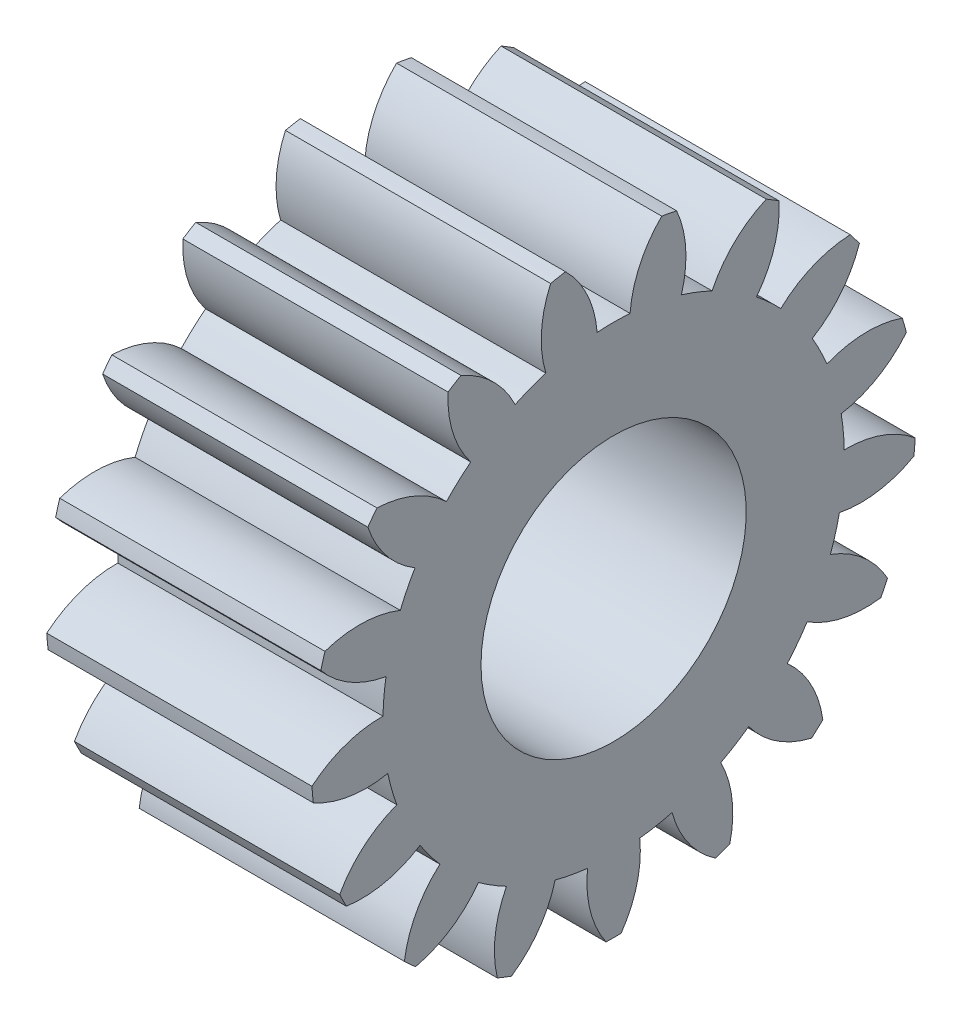
from build123d import *

# Parameters (mm, degrees)
BASPROSKE_W     = 5
BASPROSKE_H     = 5.7
TOOTHCUT_DEPTH  = 10.485778829
TEETHCUTS_COUNT = 17
TEETHCUTS_ANGLE = 338.823529412
BORSKE_R        = 2.5
BORE_DEPTH      = 50.0000508


with BuildPart() as part:
    # BasProSke → Base-Revolve (revolve)
    with BuildSketch(Plane(origin=(0, 0, 0), x_dir=(1, 0, 0), z_dir=(0, 1, 0)), mode=Mode.PRIVATE) as base_revolve_sk:
        with Locations((2.5, 2.85)):
            Rectangle(BASPROSKE_W, BASPROSKE_H)
    revolve(base_revolve_sk.sketch.rotate(Axis((-10, 0, 0), (1, 0, 0)), 180), axis=Axis((-10, 0, 0), (1, 0, 0)))

    # TooCutSke → ToothCut (cut, through all)
    with BuildSketch(Plane(origin=(0, 0, 0), x_dir=(0, 0, -1), z_dir=(1, 0, 0))):
        with BuildLine():
            ThreePointArc((0.310384518, 4.337909917), (0, 4.349), (-0.310384518, 4.337909917))
            ThreePointArc((-0.310384518, 4.337909917), (-0.499365984, 5.050550631), (-0.929319613, 5.649475216))
            ThreePointArc((-0.929319613, 5.649475216), (0, 5.7254), (0.929319613, 5.649475216))
            ThreePointArc((0.929319613, 5.649475216), (0.499365984, 5.050550631), (0.310384518, 4.337909917))
        make_face()
    toothcut = extrude(amount=TOOTHCUT_DEPTH, mode=Mode.SUBTRACT)

    # TeethCuts: ToothCut ×17 about axis
    teethcuts_axis = Axis((-10, 0, 0), (1, 0, 0))
    for i in range(1, TEETHCUTS_COUNT):
        add(toothcut.rotate(teethcuts_axis, i * TEETHCUTS_ANGLE / (TEETHCUTS_COUNT - 1)), mode=Mode.SUBTRACT)

    # BorSke → Bore (cut, symmetric)
    with BuildSketch(Plane(origin=(0, 0, 0), x_dir=(0, 0, -1), z_dir=(1, 0, 0))):
        with Locations(Location((0, 0, 0), (0, 0, 180))):
            Circle(BORSKE_R)
    extrude(amount=BORE_DEPTH, both=True, mode=Mode.SUBTRACT)


solid = part.part
